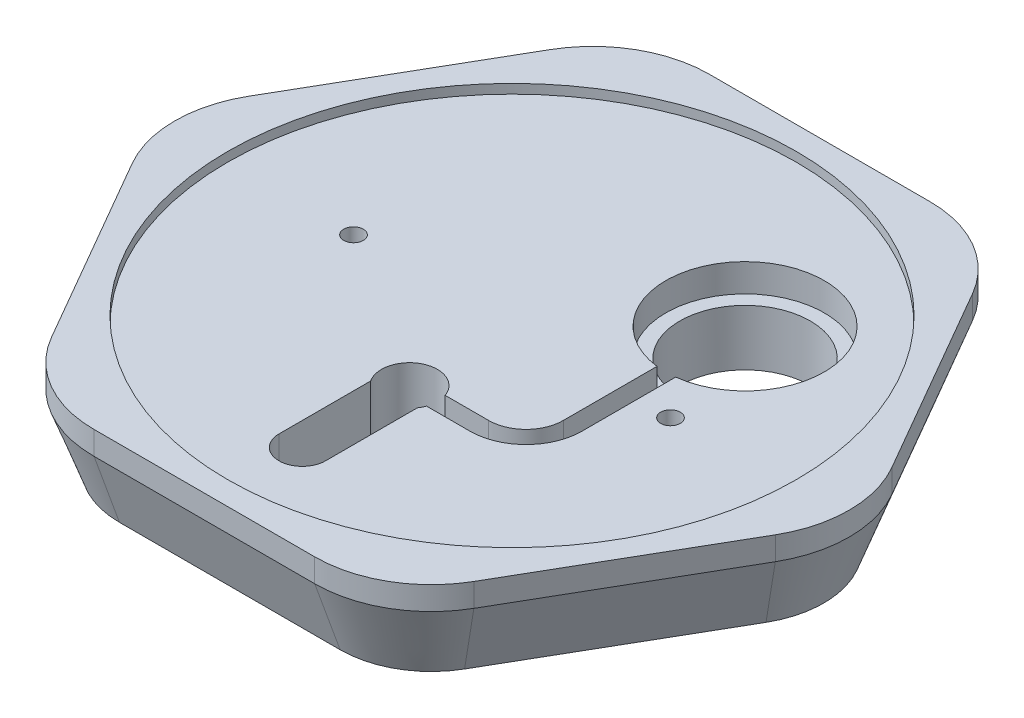
from build123d import *

# Parameters (mm, degrees)
BOSS_EXTRUDE1_DEPTH = 5
BOSS_EXTRUDE2_DEPTH = 15
BOSS_EXTRUDE2_TAPER = 20
SKETCH3_R           = 61
CUT_EXTRUDE1_DEPTH  = 2
SKETCH4_R           = 17
CUT_EXTRUDE2_DEPTH  = 6
CUT_EXTRUDE3_REACH  = 100.658
SKETCH7_R           = 14
SKETCH8_R           = 12.7
CUT_EXTRUDE4_DEPTH  = 16
SKETCH9_R           = 2.1
CUT_EXTRUDE5_DEPTH  = 20
SKETCH12_R          = 4.1
CUT_EXTRUDE7_DEPTH  = 60
SKETCH13_R          = 7.1
CUT_EXTRUDE8_DEPTH  = 15
SKETCH14_W          = 14.5
SKETCH14_H          = 7
CUT_EXTRUDE9_DEPTH  = 16
CUT_EXTRUDE10_START = -5
SKETCH15_R          = 2.1
CUT_EXTRUDE10_DEPTH = 5
CUT_EXTRUDE11_REACH = 101.566
SKETCH16_R          = 6
CUT_EXTRUDE12_DEPTH = 12
CUT_EXTRUDE13_DEPTH = 10


with BuildPart() as part:
    # Sketch1 → Boss-Extrude1 (new body)
    with BuildSketch(Plane(origin=(0, 0, 0), x_dir=(1, 0, 0), z_dir=(0, 1, 0))):
        with BuildLine():
            Line((68.993357168, 12.5), (45.321996131, 53.5))
            ThreePointArc((45.321996131, 53.5), (36.171361037, 62.650635095), (23.671361037, 66))
            Line((23.671361037, 66), (-23.671361037, 66))
            ThreePointArc((-23.671361037, 66), (-36.171361037, 62.650635095), (-45.321996131, 53.5))
            Line((-45.321996131, 53.5), (-68.993357168, 12.5))
            ThreePointArc((-68.993357168, 12.5), (-72.342722074, 0), (-68.993357168, -12.5))
            Line((-68.993357168, -12.5), (-45.321996131, -53.5))
            ThreePointArc((-45.321996131, -53.5), (-36.171361037, -62.650635095), (-23.671361037, -66))
            Line((-23.671361037, -66), (23.671361037, -66))
            ThreePointArc((23.671361037, -66), (36.171361037, -62.650635095), (45.321996131, -53.5))
            Line((45.321996131, -53.5), (68.993357168, -12.5))
            ThreePointArc((68.993357168, -12.5), (72.342722074, 0), (68.993357168, 12.5))
        make_face()
    extrude(amount=BOSS_EXTRUDE1_DEPTH)

    # Sketch2 → Boss-Extrude2 (add)
    with BuildSketch(Plane.XZ):
        with BuildLine():
            Line((-68.993357168, -12.5), (-45.321996131, -53.5))
            ThreePointArc((-45.321996131, -53.5), (-36.171361037, -62.650635095), (-23.671361037, -66))
            Line((-23.671361037, -66), (23.671361037, -66))
            ThreePointArc((23.671361037, -66), (36.171361037, -62.650635095), (45.321996131, -53.5))
            Line((45.321996131, -53.5), (68.993357168, -12.5))
            ThreePointArc((68.993357168, -12.5), (72.342722074, 0), (68.993357168, 12.5))
            Line((68.993357168, 12.5), (45.321996131, 53.5))
            ThreePointArc((45.321996131, 53.5), (36.171361037, 62.650635095), (23.671361037, 66))
            Line((23.671361037, 66), (-23.671361037, 66))
            ThreePointArc((-23.671361037, 66), (-36.171361037, 62.650635095), (-45.321996131, 53.5))
            Line((-45.321996131, 53.5), (-68.993357168, 12.5))
            ThreePointArc((-68.993357168, 12.5), (-72.342722074, 0), (-68.993357168, -12.5))
        make_face()
    extrude(amount=BOSS_EXTRUDE2_DEPTH, taper=BOSS_EXTRUDE2_TAPER)

    # Sketch3 → Cut-Extrude1 (cut)
    with BuildSketch(Plane(origin=(0, 5, 0), x_dir=(1, 0, 0), z_dir=(0, 1, 0))):
        with Locations(Location((0, 0, 0), (0, 0, 270))):
            Circle(SKETCH3_R)
    extrude(amount=-CUT_EXTRUDE1_DEPTH, mode=Mode.SUBTRACT)

    # Sketch4 → Cut-Extrude2 (cut)
    with BuildSketch(Plane(origin=(0, 3, 0), x_dir=(1, 0, 0), z_dir=(0, 1, 0))):
        with Locations(Location((25, 25, 0), (0, 0, 270))):
            Circle(SKETCH4_R)
    extrude(amount=-CUT_EXTRUDE2_DEPTH, mode=Mode.SUBTRACT)

    # Sketch7 → Cut-Extrude3 (cut, up to next)
    with BuildSketch(Plane(origin=(0, -3, 0), x_dir=(1, 0, 0), z_dir=(0, 1, 0)), mode=Mode.PRIVATE) as cut_extrude3_sk1:
        with Locations(Location((25, 25, 0), (0, 0, 270))):
            Circle(SKETCH7_R)
    cut_extrude3_tool1 = extrude(cut_extrude3_sk1.sketch, amount=-CUT_EXTRUDE3_REACH, mode=Mode.PRIVATE) & part.part
    add(cut_extrude3_tool1.solids().sort_by_distance((25, -3, -25))[0], mode=Mode.SUBTRACT)

    # Sketch8 → Cut-Extrude4 (cut)
    with BuildSketch(Plane(origin=(0, -15, 0), x_dir=(-1, 0, 0), z_dir=(0, -1, 0))):
        with Locations(Location((0, 0, 0), (0, 0, 90))):
            Circle(SKETCH8_R)
    extrude(amount=-CUT_EXTRUDE4_DEPTH, mode=Mode.SUBTRACT)

    # Sketch9 → Cut-Extrude5 (cut)
    with BuildSketch(Plane(origin=(0, 3, 0), x_dir=(1, 0, 0), z_dir=(0, 1, 0))):
        with Locations(Location((34, 0, 0), (0, 0, 270))):
            Circle(SKETCH9_R)
        with Locations(Location((-34, 0, 0), (0, 0, 270))):
            Circle(SKETCH9_R)
    extrude(amount=-CUT_EXTRUDE5_DEPTH, mode=Mode.SUBTRACT)

    # Sketch12 → Cut-Extrude7 (cut)
    with BuildSketch(Plane(origin=(0, 0, -66), x_dir=(-1, 0, 0), z_dir=(0, 0, -1))):
        with Locations(Location((0, -7, 0), (0, 0, 90))):
            Circle(SKETCH12_R)
    extrude(amount=-CUT_EXTRUDE7_DEPTH, mode=Mode.SUBTRACT)

    # Sketch13 → Cut-Extrude8 (cut)
    with BuildSketch(Plane(origin=(0, 0, -66), x_dir=(-1, 0, 0), z_dir=(0, 0, -1))):
        with Locations((0, -7)):
            Circle(SKETCH13_R)
    extrude(amount=-CUT_EXTRUDE8_DEPTH, mode=Mode.SUBTRACT)

    # Sketch14 → Cut-Extrude9 (cut)
    with BuildSketch(Plane(origin=(0, -15, 0), x_dir=(-1, 0, 0), z_dir=(0, -1, 0))):
        with Locations((0, 25)):
            Rectangle(SKETCH14_W, SKETCH14_H)
    extrude(amount=-CUT_EXTRUDE9_DEPTH, mode=Mode.SUBTRACT)

    # Sketch15 → Cut-Extrude10 (cut)
    # profile 1 of 2: a face of its own
    with BuildSketch(Plane.XZ.offset(15).offset(CUT_EXTRUDE10_START)):
        Polygon((-34, 4.156921938), (-37.6, 2.078460969), (-37.6, -2.078460969), (-34, -4.156921938), (-30.4, -2.078460969), (-30.4, 2.078460969), align=None)
        with Locations(Location((-34, 0, 0), (0, 0, 90))):
            Circle(SKETCH15_R, mode=Mode.SUBTRACT)
    # profile 2 of 2: a face of its own
    with BuildSketch(Plane.XZ.offset(15).offset(CUT_EXTRUDE10_START)):
        Polygon((34, 4.156921938), (30.4, 2.078460969), (30.4, -2.078460969), (34, -4.156921938), (37.6, -2.078460969), (37.6, 2.078460969), align=None)
        with Locations(Location((34, 0, 0), (0, 0, 90))):
            Circle(SKETCH15_R, mode=Mode.SUBTRACT)
    extrude(amount=CUT_EXTRUDE10_DEPTH, mode=Mode.SUBTRACT)

    # Sketch16 → Cut-Extrude11 (cut, up to next)
    with BuildSketch(Plane(origin=(0, 3, 0), x_dir=(1, 0, 0), z_dir=(0, 1, 0)), mode=Mode.PRIVATE) as cut_extrude11_sk1:
        with Locations(Location((0, -22, 0), (0, 0, 270))):
            Circle(SKETCH16_R)
    cut_extrude11_tool1 = extrude(cut_extrude11_sk1.sketch, amount=-CUT_EXTRUDE11_REACH, mode=Mode.PRIVATE) & part.part
    add(cut_extrude11_tool1.solids().sort_by_distance((0, 3, 22))[0], mode=Mode.SUBTRACT)

    # Sketch17 → Cut-Extrude12 (cut)
    with BuildSketch(Plane(origin=(0, 3, 0), x_dir=(1, 0, 0), z_dir=(0, 1, 0))):
        with BuildLine():
            Line((25, -12), (25, 8))
            ThreePointArc((25, 8), (23.998259334, 8.029539911), (23, 8.118056984))
            Line((23, 8.118056984), (23, -12))
            ThreePointArc((23, -12), (20.656854249, -17.656854249), (15, -20))
            Line((15, -20), (5.656854249, -20))
            ThreePointArc((5.656854249, -20), (5.913591358, -20.985388128), (6, -22))
            Line((6, -22), (15, -22))
            ThreePointArc((15, -22), (22.071067812, -19.071067812), (25, -12))
        make_face()
        with BuildLine():
            ThreePointArc((27, 8.118056984), (26.001740666, 8.029539911), (25, 8))
            Line((25, 8), (25, -12))
            ThreePointArc((25, -12), (22.071067812, -19.071067812), (15, -22))
            Line((15, -22), (6, -22))
            ThreePointArc((6, -22), (5.913591358, -23.014611872), (5.656854249, -24))
            Line((5.656854249, -24), (15, -24))
            ThreePointArc((15, -24), (23.485281374, -20.485281374), (27, -12))
            Line((27, -12), (27, 8.118056984))
        make_face()
        with BuildLine():
            Line((25, 8), (25, 25))
            Line((25, 25), (23, 25))
            Line((23, 25), (23, 8.118056984))
            ThreePointArc((23, 8.118056984), (23.998259334, 8.029539911), (25, 8))
        make_face()
        with BuildLine():
            Line((27, 25), (25, 25))
            Line((25, 25), (25, 8))
            ThreePointArc((25, 8), (26.001740666, 8.029539911), (27, 8.118056984))
            Line((27, 8.118056984), (27, 25))
        make_face()
    extrude(amount=-CUT_EXTRUDE12_DEPTH, mode=Mode.SUBTRACT)

    # Sketch18 → Cut-Extrude13 (cut)
    with BuildSketch(Plane(origin=(0, 3, 0), x_dir=(1, 0, 0), z_dir=(0, 1, 0))):
        with BuildLine():
            Line((5, -25), (5, -45))
            ThreePointArc((5, -45), (0, -50), (-5, -45))
            Line((-5, -45), (-5, -25))
            ThreePointArc((-5, -25), (0, -20), (5, -25))
        make_face()
    extrude(amount=-CUT_EXTRUDE13_DEPTH, mode=Mode.SUBTRACT)


solid = part.part
